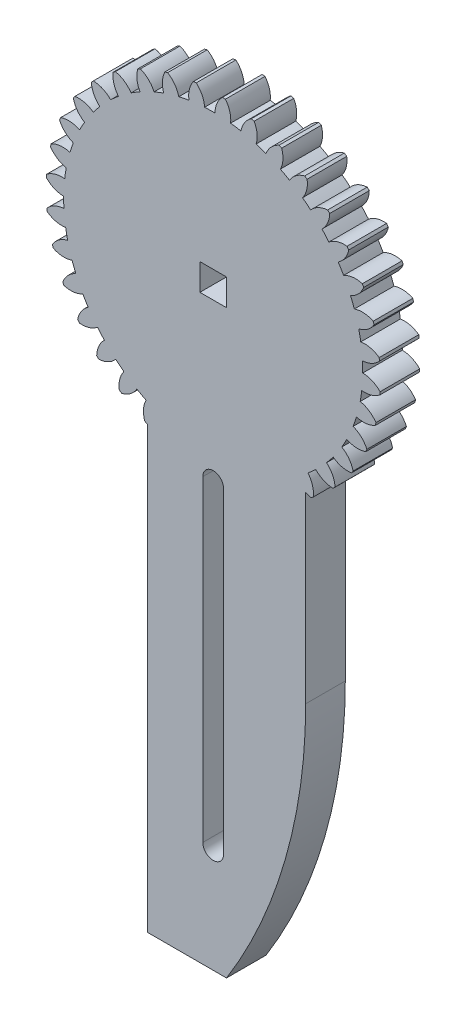
from build123d import *

# Parameters (mm, degrees)
SKETCH3_W           = 3.2
SKETCH3_H           = 3.2
BOSS_EXTRUDE2_DEPTH = 4.7625
CUT_EXTRUDE1_DEPTH  = 75.344544811


with BuildPart() as part:
    # Sketch3 → Boss-Extrude2 (new body)
    # profile 1 of 2: a face of its own
    with BuildSketch(Plane.XY):
        with BuildLine():
            Line((11.1252, -12.7), (11.1252, -38.1))
            ThreePointArc((11.1252, -38.1), (8.697206621, -55.429656085), (1.6002, -71.4248))
            Line((1.6002, -71.4248), (-7.9248, -71.4248))
            Line((-7.9248, -71.4248), (-7.9248, -12.7))
            Line((-7.9248, -12.7), (11.1252, -12.7))
        make_face()
    # profile 2 of 2: a face of its own
    with BuildSketch(Plane.XY):
        with BuildLine():
            ThreePointArc((-16.826659785, 6.352929755), (-17.038123489, 5.761817765), (-17.228828864, 5.163685888))
            ThreePointArc((-17.228828864, 5.163685888), (-18.383811499, 5.271780738), (-19.491193943, 4.926276027))
            ThreePointArc((-19.491193943, 4.926276027), (-19.533441101, 4.755997854), (-19.574200711, 4.585357493))
            ThreePointArc((-19.574200711, 4.585357493), (-18.749597816, 3.769453426), (-17.674199689, 3.33449567))
            ThreePointArc((-17.674199689, 3.33449567), (-17.779805264, 2.715643711), (-17.863748886, 2.09348316))
            ThreePointArc((-17.863748886, 2.09348316), (-19.019955212, 1.999375177), (-20.050517765, 1.466824517))
            ThreePointArc((-20.050517765, 1.466824517), (-20.062554599, 1.29179711), (-20.073063591, 1.116671327))
            ThreePointArc((-20.073063591, 1.116671327), (-19.119308013, 0.456353467), (-17.984717978, 0.214744621))
            ThreePointArc((-17.984717978, 0.214744621), (-17.981256653, -0.413043802), (-17.955887937, -1.040328995))
            ThreePointArc((-17.955887937, -1.040328995), (-19.078187211, -1.333780387), (-20.000616751, -2.037195715))
            ThreePointArc((-20.000616751, -2.037195715), (-19.982077528, -2.211654237), (-19.962016593, -2.385944333))
            ThreePointArc((-19.962016593, -2.385944333), (-18.908087711, -2.870612563), (-17.748779713, -2.911531335))
            ThreePointArc((-17.748779713, -2.911531335), (-17.636356657, -3.529181188), (-17.502446418, -4.142531277))
            ThreePointArc((-17.502446418, -4.142531277), (-18.556738145, -4.626409708), (-19.343007118, -5.479316785))
            ThreePointArc((-19.343007118, -5.479316785), (-19.294455143, -5.647905588), (-19.244433821, -5.81606428))
            ThreePointArc((-19.244433821, -5.81606428), (-18.122354732, -6.110356481), (-16.973553756, -5.949341884))
            ThreePointArc((-16.973553756, -5.949341884), (-16.755584889, -6.538086189), (-16.517201922, -7.118864843))
            ThreePointArc((-16.517201922, -7.118864843), (-17.471451981, -7.778467911), (-18.097670001, -8.754951588))
            ThreePointArc((-18.097670001, -8.754951588), (-18.020580502, -8.912548186), (-17.942118665, -9.069466059))
            ThreePointArc((-17.942118665, -9.069466059), (-16.785983174, -9.164440311), (-15.682594959, -8.806384692))
            ThreePointArc((-15.682594959, -8.806384692), (-15.365703152, -9.348334752), (-15.030090603, -9.878895305))
            ThreePointArc((-15.030090603, -9.878895305), (-15.855304589, -10.694181303), (-16.30244434, -11.764571617))
            ThreePointArc((-16.30244434, -11.764571617), (-16.199159641, -11.906387518), (-16.094641313, -12.047296701))
            ThreePointArc((-16.094641313, -12.047296701), (-14.939578013, -11.94006726), (-13.915128449, -11.395849957))
            ThreePointArc((-13.915128449, -11.395849957), (-13.508942301, -11.874538892), (-13.086297588, -12.338760531))
            ThreePointArc((-13.086297588, -12.338760531), (-13.757401791, -13.284957408), (-14.011877157, -14.416731091))
            ThreePointArc((-14.011877157, -14.416731091), (-13.885535513, -14.538457289), (-13.758136431, -14.659076328))
            ThreePointArc((-13.758136431, -14.659076328), (-12.639241334, -14.352901305), (-11.724857804, -13.639058086))
            ThreePointArc((-11.724857804, -13.639058086), (-11.241719074, -14.039941177), (-10.744884042, -14.423718762))
            ThreePointArc((-10.744884042, -14.423718762), (-11.241487301, -15.472076804), (-11.295566177, -16.630845485))
            ThreePointArc((-11.295566177, -16.630845485), (-11.150006413, -16.728783393), (-11.003597532, -16.825447339))
            ThreePointArc((-11.003597532, -16.825447339), (-9.954867701, -16.329629709), (-9.178333286, -15.467850339))
            ThreePointArc((-9.178333286, -15.467850339), (-8.632921901, -15.778746954), (-8.076992631, -16.070419598))
            ThreePointArc((-8.076992631, -16.070419598), (-8.384005907, -17.189084976), (-8.236045134, -18.339640055))
            ThreePointArc((-8.236045134, -18.339640055), (-8.07569001, -18.410813878), (-7.914719891, -18.480585646))
            ThreePointArc((-7.914719891, -18.480585646), (-6.968020451, -17.810190576), (-6.352929755, -16.826659785))
            ThreePointArc((-6.352929755, -16.826659785), (-5.761817765, -17.038123489), (-5.163685888, -17.228828864))
            ThreePointArc((-5.163685888, -17.228828864), (-5.271780738, -18.383811499), (-4.926276027, -19.491193943))
            ThreePointArc((-4.926276027, -19.491193943), (-4.755997854, -19.533441101), (-4.585357493, -19.574200711))
            ThreePointArc((-4.585357493, -19.574200711), (-3.769453426, -18.749597816), (-3.33449567, -17.674199689))
            ThreePointArc((-3.33449567, -17.674199689), (-2.715643711, -17.779805264), (-2.09348316, -17.863748886))
            ThreePointArc((-2.09348316, -17.863748886), (-1.999375177, -19.019955212), (-1.466824517, -20.050517765))
            ThreePointArc((-1.466824517, -20.050517765), (-1.29179711, -20.062554599), (-1.116671327, -20.073063591))
            ThreePointArc((-1.116671327, -20.073063591), (-0.456353467, -19.119308013), (-0.214744621, -17.984717978))
            ThreePointArc((-0.214744621, -17.984717978), (0.413043802, -17.981256653), (1.040328995, -17.955887937))
            ThreePointArc((1.040328995, -17.955887937), (1.333780387, -19.078187211), (2.037195715, -20.000616751))
            ThreePointArc((2.037195715, -20.000616751), (2.211654237, -19.982077528), (2.385944333, -19.962016593))
            ThreePointArc((2.385944333, -19.962016593), (2.870612563, -18.908087711), (2.911531335, -17.748779713))
            ThreePointArc((2.911531335, -17.748779713), (3.529181188, -17.636356657), (4.142531277, -17.502446418))
            ThreePointArc((4.142531277, -17.502446418), (4.626409708, -18.556738145), (5.479316785, -19.343007118))
            ThreePointArc((5.479316785, -19.343007118), (5.647905588, -19.294455143), (5.81606428, -19.244433821))
            ThreePointArc((5.81606428, -19.244433821), (6.110356481, -18.122354732), (5.949341884, -16.973553756))
            ThreePointArc((5.949341884, -16.973553756), (6.538086189, -16.755584889), (7.118864843, -16.517201922))
            ThreePointArc((7.118864843, -16.517201922), (7.778467911, -17.471451981), (8.754951588, -18.097670001))
            ThreePointArc((8.754951588, -18.097670001), (8.912548186, -18.020580502), (9.069466059, -17.942118665))
            ThreePointArc((9.069466059, -17.942118665), (9.164440311, -16.785983174), (8.806384692, -15.682594959))
            ThreePointArc((8.806384692, -15.682594959), (9.348334752, -15.365703152), (9.878895305, -15.030090603))
            ThreePointArc((9.878895305, -15.030090603), (10.694181303, -15.855304589), (11.764571617, -16.30244434))
            ThreePointArc((11.764571617, -16.30244434), (11.906387518, -16.199159641), (12.047296701, -16.094641313))
            ThreePointArc((12.047296701, -16.094641313), (11.94006726, -14.939578013), (11.395849957, -13.915128449))
            ThreePointArc((11.395849957, -13.915128449), (11.874538892, -13.508942301), (12.338760531, -13.086297588))
            ThreePointArc((12.338760531, -13.086297588), (13.284957408, -13.757401791), (14.416731091, -14.011877157))
            ThreePointArc((14.416731091, -14.011877157), (14.538457289, -13.885535513), (14.659076328, -13.758136431))
            ThreePointArc((14.659076328, -13.758136431), (14.352901305, -12.639241334), (13.639058086, -11.724857804))
            ThreePointArc((13.639058086, -11.724857804), (14.039941177, -11.241719074), (14.423718762, -10.744884042))
            ThreePointArc((14.423718762, -10.744884042), (15.472076804, -11.241487301), (16.630845485, -11.295566177))
            ThreePointArc((16.630845485, -11.295566177), (16.728783393, -11.150006413), (16.825447339, -11.003597532))
            ThreePointArc((16.825447339, -11.003597532), (16.329629709, -9.954867701), (15.467850339, -9.178333286))
            ThreePointArc((15.467850339, -9.178333286), (15.778746954, -8.632921901), (16.070419598, -8.076992631))
            ThreePointArc((16.070419598, -8.076992631), (17.189084976, -8.384005907), (18.339640055, -8.236045134))
            ThreePointArc((18.339640055, -8.236045134), (18.410813878, -8.07569001), (18.480585646, -7.914719891))
            ThreePointArc((18.480585646, -7.914719891), (17.810190576, -6.968020451), (16.826659785, -6.352929755))
            ThreePointArc((16.826659785, -6.352929755), (17.038123489, -5.761817765), (17.228828864, -5.163685888))
            ThreePointArc((17.228828864, -5.163685888), (18.383811499, -5.271780738), (19.491193943, -4.926276027))
            ThreePointArc((19.491193943, -4.926276027), (19.533441101, -4.755997854), (19.574200711, -4.585357493))
            ThreePointArc((19.574200711, -4.585357493), (18.749597816, -3.769453426), (17.674199689, -3.33449567))
            ThreePointArc((17.674199689, -3.33449567), (17.779805264, -2.715643711), (17.863748886, -2.09348316))
            ThreePointArc((17.863748886, -2.09348316), (19.019955212, -1.999375177), (20.050517765, -1.466824517))
            ThreePointArc((20.050517765, -1.466824517), (20.062554599, -1.29179711), (20.073063591, -1.116671327))
            ThreePointArc((20.073063591, -1.116671327), (19.119308013, -0.456353467), (17.984717978, -0.214744621))
            ThreePointArc((17.984717978, -0.214744621), (17.981256653, 0.413043802), (17.955887937, 1.040328995))
            ThreePointArc((17.955887937, 1.040328995), (19.078187211, 1.333780387), (20.000616751, 2.037195715))
            ThreePointArc((20.000616751, 2.037195715), (19.982077528, 2.211654237), (19.962016593, 2.385944333))
            ThreePointArc((19.962016593, 2.385944333), (18.908087711, 2.870612563), (17.748779713, 2.911531335))
            ThreePointArc((17.748779713, 2.911531335), (17.636356657, 3.529181188), (17.502446418, 4.142531277))
            ThreePointArc((17.502446418, 4.142531277), (18.556738145, 4.626409708), (19.343007118, 5.479316785))
            ThreePointArc((19.343007118, 5.479316785), (19.294455143, 5.647905588), (19.244433821, 5.81606428))
            ThreePointArc((19.244433821, 5.81606428), (18.122354732, 6.110356481), (16.973553756, 5.949341884))
            ThreePointArc((16.973553756, 5.949341884), (16.755584889, 6.538086189), (16.517201922, 7.118864843))
            ThreePointArc((16.517201922, 7.118864843), (17.471451981, 7.778467911), (18.097670001, 8.754951588))
            ThreePointArc((18.097670001, 8.754951588), (18.020580502, 8.912548186), (17.942118665, 9.069466059))
            ThreePointArc((17.942118665, 9.069466059), (16.785983174, 9.164440311), (15.682594959, 8.806384692))
            ThreePointArc((15.682594959, 8.806384692), (15.365703152, 9.348334752), (15.030090603, 9.878895305))
            ThreePointArc((15.030090603, 9.878895305), (15.855304589, 10.694181303), (16.30244434, 11.764571617))
            ThreePointArc((16.30244434, 11.764571617), (16.199159641, 11.906387518), (16.094641313, 12.047296701))
            ThreePointArc((16.094641313, 12.047296701), (14.939578013, 11.94006726), (13.915128449, 11.395849957))
            ThreePointArc((13.915128449, 11.395849957), (13.508942301, 11.874538892), (13.086297588, 12.338760531))
            ThreePointArc((13.086297588, 12.338760531), (13.757401791, 13.284957408), (14.011877157, 14.416731091))
            ThreePointArc((14.011877157, 14.416731091), (13.885535513, 14.538457289), (13.758136431, 14.659076328))
            ThreePointArc((13.758136431, 14.659076328), (12.639241334, 14.352901305), (11.724857804, 13.639058086))
            ThreePointArc((11.724857804, 13.639058086), (11.241719074, 14.039941177), (10.744884042, 14.423718762))
            ThreePointArc((10.744884042, 14.423718762), (11.241487301, 15.472076804), (11.295566177, 16.630845485))
            ThreePointArc((11.295566177, 16.630845485), (11.150006413, 16.728783393), (11.003597532, 16.825447339))
            ThreePointArc((11.003597532, 16.825447339), (9.954867701, 16.329629709), (9.178333286, 15.467850339))
            ThreePointArc((9.178333286, 15.467850339), (8.632921901, 15.778746954), (8.076992631, 16.070419598))
            ThreePointArc((8.076992631, 16.070419598), (8.384005907, 17.189084976), (8.236045134, 18.339640055))
            ThreePointArc((8.236045134, 18.339640055), (8.07569001, 18.410813878), (7.914719891, 18.480585646))
            ThreePointArc((7.914719891, 18.480585646), (6.968020451, 17.810190576), (6.352929755, 16.826659785))
            ThreePointArc((6.352929755, 16.826659785), (5.761817765, 17.038123489), (5.163685888, 17.228828864))
            ThreePointArc((5.163685888, 17.228828864), (5.271780738, 18.383811499), (4.926276027, 19.491193943))
            ThreePointArc((4.926276027, 19.491193943), (4.755997854, 19.533441101), (4.585357493, 19.574200711))
            ThreePointArc((4.585357493, 19.574200711), (3.769453426, 18.749597816), (3.33449567, 17.674199689))
            ThreePointArc((3.33449567, 17.674199689), (2.715643711, 17.779805264), (2.09348316, 17.863748886))
            ThreePointArc((2.09348316, 17.863748886), (1.999375177, 19.019955212), (1.466824517, 20.050517765))
            ThreePointArc((1.466824517, 20.050517765), (1.29179711, 20.062554599), (1.116671327, 20.073063591))
            ThreePointArc((1.116671327, 20.073063591), (0.456353467, 19.119308013), (0.214744621, 17.984717978))
            ThreePointArc((0.214744621, 17.984717978), (-0.413043802, 17.981256653), (-1.040328995, 17.955887937))
            ThreePointArc((-1.040328995, 17.955887937), (-1.333780387, 19.078187211), (-2.037195715, 20.000616751))
            ThreePointArc((-2.037195715, 20.000616751), (-2.211654237, 19.982077528), (-2.385944333, 19.962016593))
            ThreePointArc((-2.385944333, 19.962016593), (-2.870612563, 18.908087711), (-2.911531335, 17.748779713))
            ThreePointArc((-2.911531335, 17.748779713), (-3.529181188, 17.636356657), (-4.142531277, 17.502446418))
            ThreePointArc((-4.142531277, 17.502446418), (-4.626409708, 18.556738145), (-5.479316785, 19.343007118))
            ThreePointArc((-5.479316785, 19.343007118), (-5.647905588, 19.294455143), (-5.81606428, 19.244433821))
            ThreePointArc((-5.81606428, 19.244433821), (-6.110356481, 18.122354732), (-5.949341884, 16.973553756))
            ThreePointArc((-5.949341884, 16.973553756), (-6.538086189, 16.755584889), (-7.118864843, 16.517201922))
            ThreePointArc((-7.118864843, 16.517201922), (-7.778467911, 17.471451981), (-8.754951588, 18.097670001))
            ThreePointArc((-8.754951588, 18.097670001), (-8.912548186, 18.020580502), (-9.069466059, 17.942118665))
            ThreePointArc((-9.069466059, 17.942118665), (-9.164440311, 16.785983174), (-8.806384692, 15.682594959))
            ThreePointArc((-8.806384692, 15.682594959), (-9.348334752, 15.365703152), (-9.878895305, 15.030090603))
            ThreePointArc((-9.878895305, 15.030090603), (-10.694181303, 15.855304589), (-11.764571617, 16.30244434))
            ThreePointArc((-11.764571617, 16.30244434), (-11.906387518, 16.199159641), (-12.047296701, 16.094641313))
            ThreePointArc((-12.047296701, 16.094641313), (-11.94006726, 14.939578013), (-11.395849957, 13.915128449))
            ThreePointArc((-11.395849957, 13.915128449), (-11.874538892, 13.508942301), (-12.338760531, 13.086297588))
            ThreePointArc((-12.338760531, 13.086297588), (-13.284957408, 13.757401791), (-14.416731091, 14.011877157))
            ThreePointArc((-14.416731091, 14.011877157), (-14.538457289, 13.885535513), (-14.659076328, 13.758136431))
            ThreePointArc((-14.659076328, 13.758136431), (-14.352901305, 12.639241334), (-13.639058086, 11.724857804))
            ThreePointArc((-13.639058086, 11.724857804), (-14.039941177, 11.241719074), (-14.423718762, 10.744884042))
            ThreePointArc((-14.423718762, 10.744884042), (-15.472076804, 11.241487301), (-16.630845485, 11.295566177))
            ThreePointArc((-16.630845485, 11.295566177), (-16.728783393, 11.150006413), (-16.825447339, 11.003597532))
            ThreePointArc((-16.825447339, 11.003597532), (-16.329629709, 9.954867701), (-15.467850339, 9.178333286))
            ThreePointArc((-15.467850339, 9.178333286), (-15.778746954, 8.632921901), (-16.070419598, 8.076992631))
            ThreePointArc((-16.070419598, 8.076992631), (-17.189084976, 8.384005907), (-18.339640055, 8.236045134))
            ThreePointArc((-18.339640055, 8.236045134), (-18.410813878, 8.07569001), (-18.480585646, 7.914719891))
            ThreePointArc((-18.480585646, 7.914719891), (-17.810190576, 6.968020451), (-16.826659785, 6.352929755))
        make_face()
        Rectangle(SKETCH3_W, SKETCH3_H, mode=Mode.SUBTRACT)
    extrude(amount=BOSS_EXTRUDE2_DEPTH)

    # Sketch5 → Cut-Extrude1 (cut, through all)
    with BuildSketch(Plane.XY.offset(4.7625)):
        with BuildLine():
            Line((-1.25, -58.7248), (-1.25, -20.6248))
            ThreePointArc((-1.25, -20.6248), (0, -19.3748), (1.25, -20.6248))
            Line((1.25, -20.6248), (1.25, -58.7248))
            ThreePointArc((1.25, -58.7248), (0, -59.9748), (-1.25, -58.7248))
        make_face()
    extrude(amount=-CUT_EXTRUDE1_DEPTH, mode=Mode.SUBTRACT)


solid = part.part
